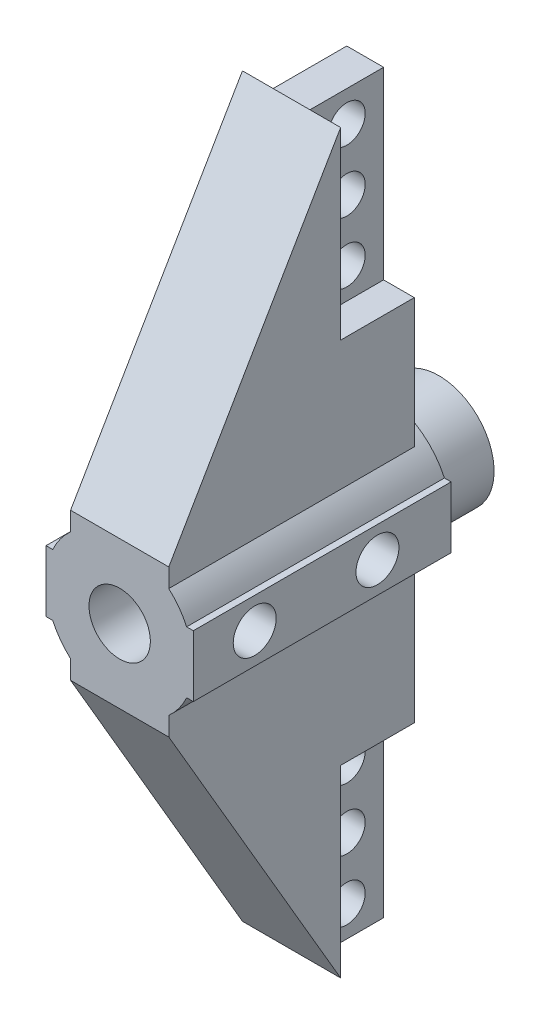
from build123d import *

# Parameters (mm, degrees)
SKETCH1_R             = 6
SKETCH1_R_2           = 2.5
BOSS_EXTRUDE1_DEPTH   = 20
BOSS_EXTRUDE2_DEPTH   = 4
SKETCH3_W             = 2.5
SKETCH3_H             = 6
CUT_EXTRUDE1_DEPTH    = 15
BODY_MOVE_COPY1_ANGLE = 180
BOSS_EXTRUDE3_START   = 1
SKETCH4_R             = 6
BOSS_EXTRUDE3_DEPTH   = 1
SKETCH5_R             = 4.5
BOSS_EXTRUDE4_DEPTH   = 5
SKETCH6_R             = 3.5
CUT_EXTRUDE2_DEPTH    = 5
SKETCH7_W             = 1.05927087
SKETCH7_H             = 5
SKETCH7_W_2           = 1.30456568
BOSS_EXTRUDE5_DEPTH   = 21
SKETCH8_R             = 1.75
CUT_EXTRUDE3_DEPTH    = 39
SKETCH9_R             = 1.5
CUT_EXTRUDE4_DEPTH    = 37.827299731
SKETCH11_R            = 1.5
CUT_EXTRUDE5_DEPTH    = 37.827299731


with BuildPart() as part:
    # Sketch1 → Boss-Extrude1 (new body)
    with BuildSketch(Plane.XY):
        Circle(SKETCH1_R)
        Circle(SKETCH1_R_2, mode=Mode.SUBTRACT)
    extrude(amount=BOSS_EXTRUDE1_DEPTH)

    # Sketch2 → Boss-Extrude2 (add, symmetric)
    with BuildSketch(Plane(origin=(0, 0, 0), x_dir=(0, 0, -1), z_dir=(1, 0, 0))):
        Polygon((-20, 6), (-20, 3), (0, 3), (0, 30), (-6, 30), align=None)
    extrude(amount=BOSS_EXTRUDE2_DEPTH, both=True)

    # Sketch3 → Cut-Extrude1 (cut)
    with BuildSketch(Plane(origin=(0, 30, 0), x_dir=(1, 0, 0), z_dir=(0, 1, 0))):
        with Locations((-2.75, -3)):
            Rectangle(SKETCH3_W, SKETCH3_H)
        with Locations((2.75, -3)):
            Rectangle(SKETCH3_W, SKETCH3_H)
    extrude(amount=-CUT_EXTRUDE1_DEPTH, mode=Mode.SUBTRACT)


with BuildPart() as body_2:
    # Body-Move/Copy1: copy of part
    add(part.part.rotate(Axis((0, 0, 0), (0, 0, 1)), BODY_MOVE_COPY1_ANGLE))


with BuildPart() as part_1:
    add(part.part)

    add(body_2.part)  # Boss-Extrude3 merges body 2
    # Sketch4 → Boss-Extrude3 (add)
    with BuildSketch(Plane(origin=(0, 0, 0), x_dir=(-1, 0, 0), z_dir=(0, 0, -1)).offset(BOSS_EXTRUDE3_START)):
        Circle(SKETCH4_R)
    extrude(amount=-BOSS_EXTRUDE3_DEPTH)

    # Sketch5 → Boss-Extrude4 (add)
    with BuildSketch(Plane(origin=(0, 0, -1), x_dir=(-1, 0, 0), z_dir=(0, 0, -1))):
        Circle(SKETCH5_R)
    extrude(amount=BOSS_EXTRUDE4_DEPTH)

    # Sketch6 → Cut-Extrude2 (cut)
    with BuildSketch(Plane(origin=(0, 0, -6), x_dir=(-1, 0, 0), z_dir=(0, 0, -1))):
        Circle(SKETCH6_R)
    extrude(amount=-CUT_EXTRUDE2_DEPTH, mode=Mode.SUBTRACT)

    # Sketch7 → Boss-Extrude5 (add)
    with BuildSketch(Plane.XY.offset(20)):
        with Locations((-5.470364565, 0)):
            Rectangle(SKETCH7_W, SKETCH7_H)
        with Locations((5.34771716, 0)):
            Rectangle(SKETCH7_W_2, SKETCH7_H)
    extrude(amount=-BOSS_EXTRUDE5_DEPTH)

    # Sketch8 → Cut-Extrude3 (cut, through all)
    with BuildSketch(Plane.ZY.offset(6)):
        with Locations((5, 0)):
            Circle(SKETCH8_R)
        with Locations((15, 0)):
            Circle(SKETCH8_R)
    extrude(amount=-CUT_EXTRUDE3_DEPTH, mode=Mode.SUBTRACT)

    # Sketch9 → Cut-Extrude4 (cut, through all)
    with BuildSketch(Plane.ZY.offset(1.5)):
        with Locations((3, 17.5)):
            Circle(SKETCH9_R)
        with Locations((3, 22.5)):
            Circle(SKETCH9_R)
        with Locations((3, 27.5)):
            Circle(SKETCH9_R)
    extrude(amount=-CUT_EXTRUDE4_DEPTH, mode=Mode.SUBTRACT)

    # Sketch11 → Cut-Extrude5 (cut, through all)
    with BuildSketch(Plane.ZY.offset(1.5)):
        with Locations(Location((3, -17.5, 0), (0, 0, 270))):
            Circle(SKETCH11_R)
        with Locations(Location((3, -22.5, 0), (0, 0, 270))):
            Circle(SKETCH11_R)
        with Locations(Location((3, -27.5, 0), (0, 0, 270))):
            Circle(SKETCH11_R)
    extrude(amount=-CUT_EXTRUDE5_DEPTH, mode=Mode.SUBTRACT)


solid = part_1.part
